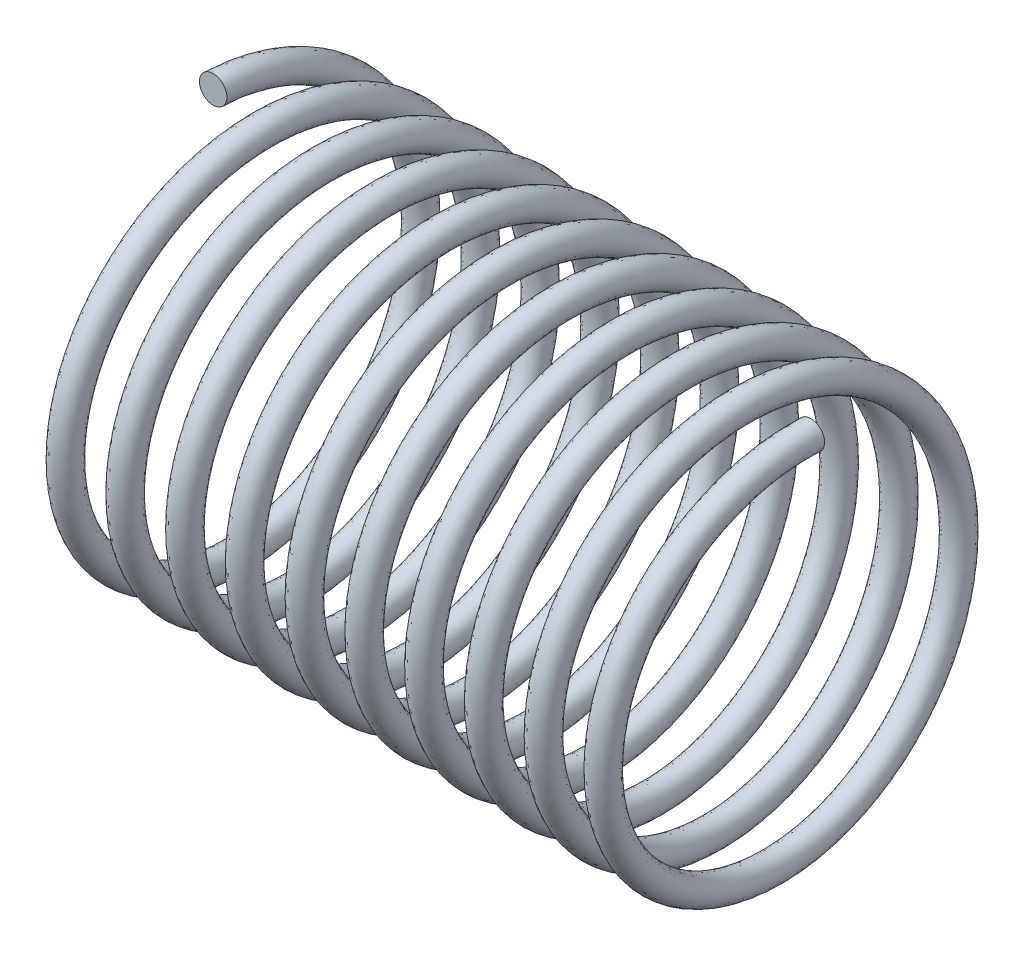
from build123d import *

# Parameters (mm, degrees)
SWEEP1_PITCH       = 1.74
SWEEP1_HEIGHT      = 17.4
SWEEP1_RADIUS      = 5.6
SWEEP1_START_ANGLE = -90
SKETCH2_R          = 0.4


with BuildPart() as part:
    # Sweep1: sweep along a helix
    with BuildLine() as sweep1_path:
        add(Helix(SWEEP1_PITCH, SWEEP1_HEIGHT, SWEEP1_RADIUS, center=(0, 0, 0), direction=(1, 0, 0), lefthand=True, mode=Mode.PRIVATE).rotate(Axis((0, 0, 0), (1, 0, 0)), SWEEP1_START_ANGLE))
    # Sketch2 → Sweep1 (sweep)
    with BuildSketch(Plane.XY):
        with Locations((0, 5.6)):
            Circle(SKETCH2_R)
    sweep(path=sweep1_path.line, is_frenet=True)


solid = part.part
